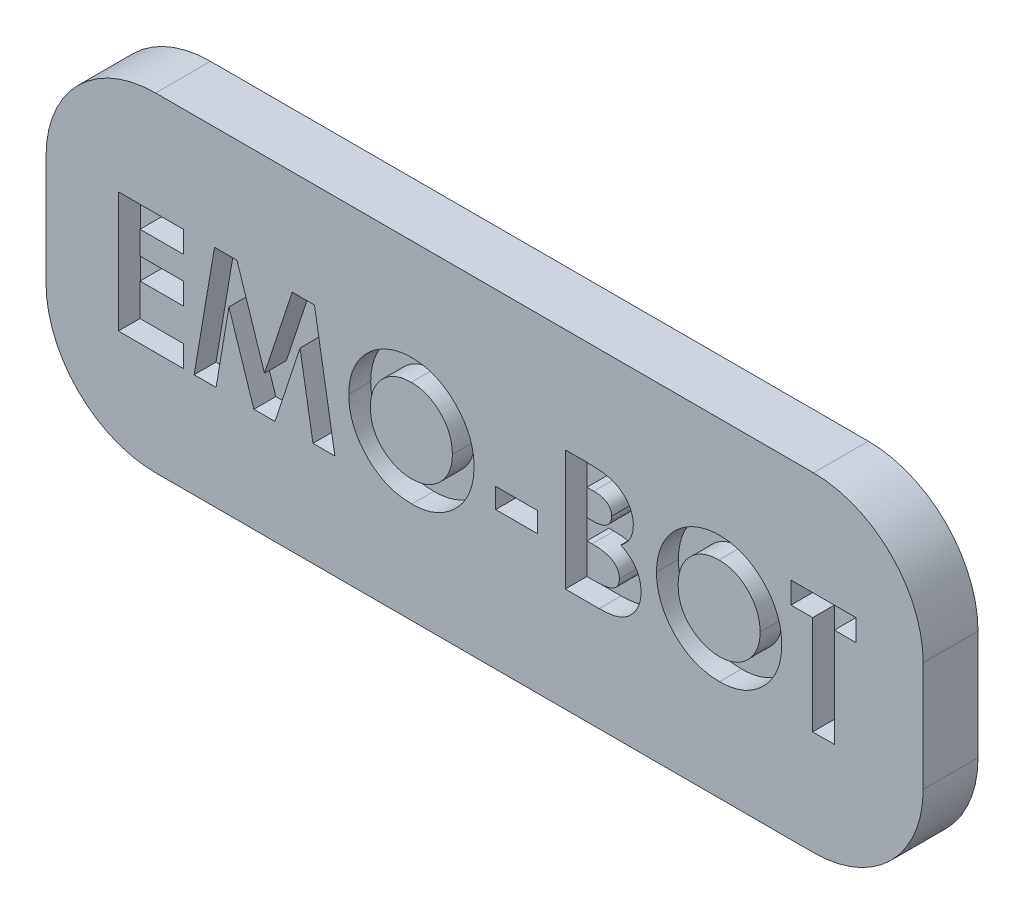
from build123d import *

# Parameters (mm, degrees)
SKETCH1_W           = 80
SKETCH1_H           = 30
BOSS_EXTRUDE1_DEPTH = 5
SKETCH2_W           = 3.807692308
SKETCH2_H           = 1.833333333
CUT_EXTRUDE1_DEPTH  = 2
FILLET1_R           = 10


with BuildPart() as part:
    # Sketch1 → Boss-Extrude1 (new body)
    with BuildSketch(Plane.XY):
        Rectangle(SKETCH1_W, SKETCH1_H)
    extrude(amount=-BOSS_EXTRUDE1_DEPTH)

    # Sketch2 → Cut-Extrude1 (cut)
    # profile 1 of 7: a face of its own
    with BuildSketch(Plane.XY):
        Polygon((-33.399654604, 5.5), (-27.476577681, 5.5), (-27.476577681, 3.525641026), (-31.42529563, 3.525641026), (-31.42529563, 1.41025641), (-27.476577681, 1.41025641), (-27.476577681, -0.564102564), (-31.42529563, -0.564102564), (-31.42529563, -3.525641026), (-27.476577681, -3.525641026), (-27.476577681, -5.5), (-33.399654604, -5.5), align=None)
    # profile 2 of 7: a face of its own
    with BuildSketch(Plane.XY):
        Polygon((-24.631826079, 5.5), (-22.582547233, 5.5), (-20.072731528, -2.172676282), (-17.545287617, 5.5), (-15.515840502, 5.5), (-13.656064861, -5.5), (-15.654662617, -5.5), (-16.829141784, 1.447716346), (-19.116401399, -5.5), (-21.04228281, -5.5), (-23.316321271, 1.447716346), (-24.488596912, -5.5), (-26.489398194, -5.5), align=None)
    # profile 3 of 7: a face of its own
    with BuildSketch(Plane.XY):
        with BuildLine():
            add(Edge.make_bspline(
                [(-6.653260374, 5.782051282), (-6.462011892, 5.777099516), (-6.084444074, 5.767323609), (-5.529178062, 5.685833795), (-4.994076592, 5.553057825), (-4.479381634, 5.368489624), (-3.986381926, 5.127130145), (-3.513338492, 4.83582209), (-3.061945751, 4.489067192), (-2.636829215, 4.094954672), (-2.243944865, 3.666374516), (-1.903510346, 3.204931782), (-1.613200277, 2.722582915), (-1.372590515, 2.218035447), (-1.189321396, 1.687795147), (-1.060713876, 1.134565539), (-0.978089915, 0.558504013), (-0.968586888, 0.166284631), (-0.963757169, -0.033052885)],
                knots=[0, 0, 0, 0, 1.014329547, 2.002516266, 2.970391464, 3.935626869, 4.897733899, 5.877609409, 6.878433252, 7.912639331, 8.949961323, 9.958554974, 10.949718813, 11.932905612, 12.9188844, 13.919928257, 14.942845884, 16, 16, 16, 16], degree=3))
            add(Edge.make_bspline(
                [(-0.963757169, -0.033052885), (-0.968900611, -0.230144327), (-0.97903593, -0.618519338), (-1.057340804, -1.18927223), (-1.188114092, -1.736575596), (-1.368274822, -2.261668269), (-1.604520832, -2.762006879), (-1.889169539, -3.24078602), (-2.229732279, -3.693562506), (-2.613787394, -4.12009336), (-3.036598745, -4.507261634), (-3.484423086, -4.848453007), (-3.955192641, -5.1375657), (-4.448218354, -5.374467287), (-4.964557495, -5.558317884), (-5.502934642, -5.688037839), (-6.063316482, -5.766871275), (-6.444403308, -5.776940391), (-6.637835694, -5.782051282)],
                knots=[0, 0, 0, 0, 1.051557043, 2.072126891, 3.067553643, 4.050577992, 5.02905126, 6.015227836, 7.017913613, 8.04756643, 9.074058332, 10.072836633, 11.047628519, 12.017157415, 12.98668631, 13.966869689, 14.968021931, 16, 16, 16, 16], degree=3))
            add(Edge.make_bspline(
                [(-6.637835694, -5.782051282), (-6.840142776, -5.777466561), (-7.23764854, -5.768458211), (-7.819400005, -5.682792916), (-8.376768176, -5.553751057), (-8.905070839, -5.361163004), (-9.409688306, -5.120411744), (-9.886913003, -4.823912134), (-10.336584553, -4.472154161), (-10.756123565, -4.074146479), (-11.136226926, -3.638638778), (-11.471742699, -3.178563512), (-11.754757697, -2.697435252), (-11.985282274, -2.19502882), (-12.16701859, -1.674466549), (-12.295212912, -1.132578064), (-12.370940357, -0.570663012), (-12.381488751, -0.188999076), (-12.386834092, 0.004407051)],
                knots=[0, 0, 0, 0, 1.067978421, 2.098431617, 3.099715153, 4.085208694, 5.062210972, 6.048429807, 7.046490867, 8.072918869, 9.098532598, 10.095778865, 11.076610158, 12.041847152, 13.011192615, 13.984257998, 14.978533688, 16, 16, 16, 16], degree=3))
            add(Edge.make_bspline(
                [(-12.386834092, 0.004407051), (-12.385156416, 0.134520569), (-12.381822307, 0.393100068), (-12.341659456, 0.776301686), (-12.283836497, 1.152023723), (-12.198319084, 1.51876817), (-12.094437286, 1.879122238), (-11.959843741, 2.229731663), (-11.806639863, 2.574341916), (-11.627635556, 2.90888272), (-11.428600075, 3.23027602), (-11.211434645, 3.537005747), (-10.975593205, 3.825363091), (-10.721835481, 4.097243016), (-10.449286987, 4.350858438), (-10.161532818, 4.589799634), (-9.852992218, 4.807719478), (-9.530418174, 5.009940006), (-9.195629283, 5.192804523), (-8.84998844, 5.348453331), (-8.500616529, 5.484378783), (-8.142846412, 5.59165716), (-7.780512234, 5.679034276), (-7.409743186, 5.736818263), (-7.033888957, 5.776980002), (-6.780437671, 5.780356844), (-6.653260374, 5.782051282)],
                knots=[0, 0, 0, 0, 1.034744296, 2.056386356, 3.06226378, 4.057406941, 5.050368692, 6.043467995, 7.042652155, 8.049140477, 9.059438543, 10.048523776, 11.036952808, 12.020949711, 13.004946614, 13.997082645, 14.994316842, 16.007702937, 17.024872941, 18.026463647, 19.021641123, 20.005082605, 20.995858141, 21.984425357, 22.988620895, 24, 24, 24, 24], degree=3))
        make_face()
        with BuildLine():
            add(Edge.make_bspline(
                [(-6.684109733, 3.807692308), (-6.812819935, 3.804238724), (-7.06684237, 3.797422732), (-7.43944702, 3.745494089), (-7.797160643, 3.662558145), (-8.13800029, 3.542426444), (-8.46344319, 3.389529277), (-8.774066253, 3.204400887), (-9.065567991, 2.980677691), (-9.341835299, 2.730370391), (-9.591397351, 2.451470535), (-9.811893297, 2.152581907), (-9.996412889, 1.834203647), (-10.150949203, 1.499293413), (-10.267280797, 1.144085228), (-10.350140304, 0.771361477), (-10.402504419, 0.380479937), (-10.409104981, 0.114016501), (-10.412475117, -0.022035256)],
                knots=[0, 0, 0, 0, 1.033739768, 2.040188636, 3.016340934, 3.979330865, 4.937572243, 5.900995986, 6.878200029, 7.884839167, 8.891893314, 9.879764717, 10.863503415, 11.843163062, 12.837761627, 13.859916423, 14.907309254, 16, 16, 16, 16], degree=3))
            add(Edge.make_bspline(
                [(-10.412475117, -0.022035256), (-10.408006831, -0.172811208), (-10.399249731, -0.46830709), (-10.337633711, -0.899368522), (-10.232214834, -1.306463262), (-10.079992025, -1.68760027), (-9.891195805, -2.047011787), (-9.656740865, -2.380292714), (-9.380424263, -2.689438582), (-9.167552192, -2.869930817), (-9.059510374, -2.961538462)],
                knots=[0, 0, 0, 0, 1.078454662, 2.113592447, 3.107694534, 4.079536787, 5.043276885, 6.005368276, 6.987637804, 8, 8, 8, 8], degree=3))
            add(Edge.make_bspline(
                [(-9.059510374, -2.961538462), (-8.971003498, -3.029214671), (-8.795983823, -3.163042334), (-8.516614315, -3.334569938), (-8.228918733, -3.481586206), (-7.930726052, -3.600373611), (-7.62266604, -3.693809787), (-7.304780942, -3.759241605), (-6.977521173, -3.800305729), (-6.75621278, -3.80521367), (-6.644446271, -3.807692308)],
                knots=[0, 0, 0, 0, 1.023928204, 2.024787132, 3.009472467, 3.9914905, 4.972207045, 5.96565515, 6.972602802, 8, 8, 8, 8], degree=3))
            add(Edge.make_bspline(
                [(-6.644446271, -3.807692308), (-6.517949244, -3.804209441), (-6.269062364, -3.797356792), (-5.90339395, -3.74606742), (-5.553072504, -3.659267284), (-5.2159232, -3.540189421), (-4.892918226, -3.385372498), (-4.585636194, -3.194502005), (-4.293538357, -2.969921588), (-4.017623011, -2.716327205), (-3.765423341, -2.436328676), (-3.545387525, -2.135845807), (-3.355001132, -1.821499135), (-3.203678403, -1.48883956), (-3.08275081, -1.141007231), (-3.00088856, -0.776461676), (-2.948082087, -0.396705688), (-2.941479665, -0.138268318), (-2.938116143, -0.006610577)],
                knots=[0, 0, 0, 0, 1.026359118, 2.019393844, 2.989460624, 3.950973911, 4.916101784, 5.890408035, 6.881132271, 7.902007068, 8.92769091, 9.933912415, 10.920395702, 11.90457117, 12.894218921, 13.903490204, 14.931958862, 16, 16, 16, 16], degree=3))
            add(Edge.make_bspline(
                [(-2.938116143, -0.006610577), (-2.941596044, 0.124290095), (-2.948445698, 0.381948105), (-2.999825342, 0.760727743), (-3.086075014, 1.123663937), (-3.205510456, 1.4713494), (-3.358023191, 1.804124994), (-3.54662066, 2.120820481), (-3.770641098, 2.421129696), (-4.024928688, 2.703006146), (-4.3017051, 2.962032547), (-4.598852235, 3.186820378), (-4.90805558, 3.382153855), (-5.23640977, 3.535170214), (-5.577196953, 3.657078022), (-5.93249663, 3.746852682), (-6.30365452, 3.79705793), (-6.556160907, 3.804115918), (-6.684109733, 3.807692308)],
                knots=[0, 0, 0, 0, 1.055025985, 2.07665775, 3.074803781, 4.057872707, 5.035505728, 6.020516407, 7.023567878, 8.050795229, 9.077271434, 10.074415901, 11.050397877, 12.019801805, 12.988065821, 13.964604439, 14.968634123, 16, 16, 16, 16], degree=3))
        make_face(mode=Mode.SUBTRACT)
    # profile 4 of 7: a face of its own
    with BuildSketch(Plane.XY):
        with Locations((2.91444796, -1.480769231)):
            Rectangle(SKETCH2_W, SKETCH2_H)
    # profile 5 of 7: a face of its own
    with BuildSketch(Plane.XY):
        with BuildLine():
            Line((7.356755652, -5.5), (7.356755652, 5.5))
            Line((7.356755652, 5.5), (9.119576165, 5.5))
            add(Edge.make_bspline(
                [(9.119576165, 5.5), (9.242984623, 5.500014084), (9.48177765, 5.500041336), (9.826293669, 5.487943065), (10.145803182, 5.472292595), (10.439289384, 5.454783359), (10.707251811, 5.424611447), (10.949282981, 5.392813548), (11.165866475, 5.354467241), (11.29976828, 5.320069416), (11.362765267, 5.303886218)],
                knots=[0, 0, 0, 0, 1.311965854, 2.538629056, 3.664479157, 4.713267157, 5.663616078, 6.530575999, 7.308677837, 8, 8, 8, 8], degree=3))
            add(Edge.make_bspline(
                [(11.362765267, 5.303886218), (11.445486708, 5.281059529), (11.607812731, 5.236266239), (11.840315397, 5.145804252), (12.060876608, 5.04524934), (12.269227065, 4.930534992), (12.464087413, 4.800276285), (12.644717117, 4.653439446), (12.815011911, 4.4959185), (12.968925017, 4.323323382), (13.108037106, 4.140944669), (13.22890057, 3.948830148), (13.333915429, 3.749917377), (13.417954822, 3.541703169), (13.481276927, 3.325146408), (13.52759045, 3.101171825), (13.557607884, 2.86907071), (13.560444138, 2.711164734), (13.561883857, 2.631009615)],
                knots=[0, 0, 0, 0, 1.099996261, 2.158545794, 3.195537121, 4.207578794, 5.205712374, 6.197378256, 7.190519799, 8.17788031, 9.159561366, 10.129234751, 11.085776129, 12.040971148, 13.00380137, 13.975669004, 14.972423361, 16, 16, 16, 16], degree=3))
            add(Edge.make_bspline(
                [(13.561883857, 2.631009615), (13.558119419, 2.528031327), (13.550709586, 2.32533122), (13.503375064, 2.027601434), (13.414615461, 1.746203993), (13.298475679, 1.475952848), (13.140561885, 1.217856038), (12.940041908, 0.97203628), (12.700163515, 0.730924415), (12.516163545, 0.586394116), (12.420457575, 0.511217949)],
                knots=[0, 0, 0, 0, 0.986156485, 1.941127874, 2.875419072, 3.804401753, 4.751181392, 5.761612777, 6.835722519, 8, 8, 8, 8], degree=3))
            add(Edge.make_bspline(
                [(12.420457575, 0.511217949), (12.498013102, 0.471626525), (12.650078034, 0.393998696), (12.865965562, 0.266401719), (13.065853848, 0.130686151), (13.250639129, -0.010417356), (13.416445322, -0.162890384), (13.570118844, -0.317947228), (13.704078241, -0.484472), (13.823868772, -0.65652944), (13.927988754, -0.83661096), (14.018665777, -1.024412442), (14.095257405, -1.220575458), (14.160117177, -1.424101697), (14.208489613, -1.635691193), (14.240029469, -1.85541962), (14.264178355, -2.082537591), (14.266056911, -2.237244682), (14.267012062, -2.315905449)],
                knots=[0, 0, 0, 0, 1.164658916, 2.283573913, 3.35186032, 4.395461096, 5.390182219, 6.362969632, 7.312859996, 8.245001507, 9.165155236, 10.092416118, 11.032087915, 11.979892451, 12.947605196, 13.931445124, 14.948243989, 16, 16, 16, 16], degree=3))
            add(Edge.make_bspline(
                [(14.267012062, -2.315905449), (14.260813769, -2.466143016), (14.248581461, -2.762636251), (14.159144796, -3.197956416), (14.004090036, -3.610679415), (13.795883468, -3.999164912), (13.539332916, -4.352166888), (13.244373352, -4.661393555), (12.913974341, -4.923147063), (12.60914132, -5.099810375), (12.345484763, -5.218367978), (12.127102963, -5.291667764), (11.892565538, -5.359572575), (11.637576327, -5.407256736), (11.366757936, -5.450902523), (11.077469868, -5.477850336), (10.770252799, -5.496112205), (10.559242835, -5.498677868), (10.450505652, -5.5)],
                knots=[0, 0, 0, 0, 1.284142165, 2.534249414, 3.780121997, 5.041676246, 6.291546858, 7.49970053, 8.684500223, 9.883330709, 10.50184324, 11.153274765, 11.851151195, 12.587658647, 13.369265475, 14.195992086, 15.070362669, 16, 16, 16, 16], degree=3))
            Line((10.450505652, -5.5), (7.356755652, -5.5))
        make_face()
        with BuildLine():
            Line((9.331114626, 3.525641026), (9.331114626, 1.128205128))
            Line((9.331114626, 1.128205128), (9.855553729, 1.128205128))
            add(Edge.make_bspline(
                [(9.855553729, 1.128205128), (9.926829715, 1.128826682), (10.064423692, 1.130026553), (10.263163597, 1.145480482), (10.447959614, 1.171845845), (10.61811085, 1.208632158), (10.775202327, 1.255345412), (10.918230499, 1.311551517), (11.046566496, 1.380129074), (11.195663243, 1.482278372), (11.353269256, 1.632595637), (11.492008056, 1.849760071), (11.573724284, 2.099498343), (11.582825267, 2.275633111), (11.587524883, 2.366586538)],
                knots=[0, 0, 0, 0, 1.065314748, 2.056525647, 2.977365736, 3.853934255, 4.656397591, 5.425096493, 6.14721249, 6.826394842, 8.123232004, 9.372140726, 10.643011755, 12, 12, 12, 12], degree=3))
            add(Edge.make_bspline(
                [(11.587524883, 2.366586538), (11.58376433, 2.451779535), (11.576493453, 2.616496771), (11.494215718, 2.84777444), (11.366422131, 3.052733789), (11.215543839, 3.193011701), (11.073462609, 3.28881738), (10.951803941, 3.351901339), (10.818274417, 3.408373455), (10.670289049, 3.451553411), (10.508692915, 3.48395413), (10.334270977, 3.507748577), (10.146722298, 3.523944091), (10.017182026, 3.525063248), (9.950305331, 3.525641026)],
                knots=[0, 0, 0, 0, 1.347982417, 2.606269829, 3.849316587, 5.153353503, 5.842674298, 6.568177932, 7.326619318, 8.142485038, 9.012069166, 9.942760135, 10.937925643, 12, 12, 12, 12], degree=3))
            Line((9.950305331, 3.525641026), (9.331114626, 3.525641026))
        make_face(mode=Mode.SUBTRACT)
        with BuildLine():
            Line((9.331114626, -0.705128205), (9.331114626, -3.525641026))
            Line((9.331114626, -3.525641026), (9.899624242, -3.525641026))
            add(Edge.make_bspline(
                [(9.899624242, -3.525641026), (10.012019317, -3.524998917), (10.228112873, -3.523764382), (10.53766651, -3.50884827), (10.819128154, -3.481964606), (11.071752039, -3.448402518), (11.295925105, -3.402931137), (11.490889594, -3.345120104), (11.659319192, -3.281517899), (11.800203985, -3.202961623), (11.915298791, -3.111541599), (12.019159785, -3.018108139), (12.103841569, -2.910323815), (12.170843376, -2.792815509), (12.228833322, -2.668502214), (12.263808762, -2.532529539), (12.290437835, -2.388927389), (12.291903304, -2.289600887), (12.292653088, -2.238782051)],
                knots=[0, 0, 0, 0, 1.753078804, 3.370512758, 4.83203934, 6.162291463, 7.344201807, 8.395507345, 9.331626367, 10.147333109, 10.898971645, 11.62040215, 12.321813352, 13.025280112, 13.727906689, 14.453419512, 15.208716525, 16, 16, 16, 16], degree=3))
            add(Edge.make_bspline(
                [(12.292653088, -2.238782051), (12.290999599, -2.180669913), (12.287779046, -2.067483102), (12.261476758, -1.902048497), (12.213676907, -1.747604318), (12.153470663, -1.600201216), (12.069690476, -1.465116738), (11.970120587, -1.337676121), (11.849814742, -1.222194898), (11.714523801, -1.111688334), (11.556720313, -1.01493385), (11.376330241, -0.930982196), (11.172373608, -0.860868867), (10.944218636, -0.805044589), (10.69286554, -0.757667295), (10.416479719, -0.729377821), (10.117363008, -0.708337695), (9.909950612, -0.706222344), (9.802669114, -0.705128205)],
                knots=[0, 0, 0, 0, 0.845221588, 1.646264278, 2.427170338, 3.19324141, 3.95557735, 4.731569926, 5.540061037, 6.376114724, 7.268642756, 8.224665384, 9.265483498, 10.400594375, 11.639216012, 12.983232105, 14.439614077, 16, 16, 16, 16], degree=3))
            Line((9.802669114, -0.705128205), (9.331114626, -0.705128205))
        make_face(mode=Mode.SUBTRACT)
    # profile 6 of 7: a face of its own
    with BuildSketch(Plane.XY):
        with BuildLine():
            add(Edge.make_bspline(
                [(21.41084219, 5.782051282), (21.602090672, 5.777099516), (21.97965849, 5.767323609), (22.534924502, 5.685833795), (23.070025972, 5.553057825), (23.58472093, 5.368489624), (24.077720638, 5.127130145), (24.550764072, 4.83582209), (25.002156813, 4.489067192), (25.427273349, 4.094954672), (25.820157699, 3.666374516), (26.160592219, 3.204931782), (26.450902287, 2.722582915), (26.691512049, 2.218035447), (26.874781168, 1.687795147), (27.003388689, 1.134565539), (27.086012649, 0.558504013), (27.095515676, 0.166284631), (27.100345396, -0.033052885)],
                knots=[0, 0, 0, 0, 1.014329547, 2.002516266, 2.970391464, 3.935626869, 4.897733899, 5.877609409, 6.878433252, 7.912639331, 8.949961323, 9.958554974, 10.949718813, 11.932905612, 12.9188844, 13.919928257, 14.942845884, 16, 16, 16, 16], degree=3))
            add(Edge.make_bspline(
                [(27.100345396, -0.033052885), (27.095201953, -0.230144327), (27.085066634, -0.618519338), (27.00676176, -1.18927223), (26.875988473, -1.736575596), (26.695827742, -2.261668269), (26.459581732, -2.762006879), (26.174933025, -3.24078602), (25.834370285, -3.693562506), (25.450315171, -4.12009336), (25.027503819, -4.507261634), (24.579679478, -4.848453007), (24.108909923, -5.1375657), (23.61588421, -5.374467287), (23.099545069, -5.558317884), (22.561167922, -5.688037839), (22.000786082, -5.766871275), (21.619699256, -5.776940391), (21.42626687, -5.782051282)],
                knots=[0, 0, 0, 0, 1.051557043, 2.072126891, 3.067553643, 4.050577992, 5.02905126, 6.015227836, 7.017913613, 8.04756643, 9.074058332, 10.072836633, 11.047628519, 12.017157415, 12.98668631, 13.966869689, 14.968021931, 16, 16, 16, 16], degree=3))
            add(Edge.make_bspline(
                [(21.42626687, -5.782051282), (21.223959788, -5.777466561), (20.826454024, -5.768458211), (20.244702559, -5.682792916), (19.687334388, -5.553751057), (19.159031725, -5.361163004), (18.654414258, -5.120411744), (18.177189561, -4.823912134), (17.727518011, -4.472154161), (17.307978999, -4.074146479), (16.927875638, -3.638638778), (16.592359865, -3.178563512), (16.309344867, -2.697435252), (16.07882029, -2.19502882), (15.897083974, -1.674466549), (15.768889652, -1.132578064), (15.693162207, -0.570663012), (15.682613814, -0.188999076), (15.677268472, 0.004407051)],
                knots=[0, 0, 0, 0, 1.067978421, 2.098431617, 3.099715153, 4.085208694, 5.062210972, 6.048429807, 7.046490867, 8.072918869, 9.098532598, 10.095778865, 11.076610158, 12.041847152, 13.011192615, 13.984257998, 14.978533688, 16, 16, 16, 16], degree=3))
            add(Edge.make_bspline(
                [(15.677268472, 0.004407051), (15.678946148, 0.134520569), (15.682280257, 0.393100068), (15.722443109, 0.776301686), (15.780266067, 1.152023723), (15.86578348, 1.51876817), (15.969665279, 1.879122238), (16.104258823, 2.229731663), (16.257462701, 2.574341916), (16.436467008, 2.90888272), (16.635502489, 3.23027602), (16.852667919, 3.537005747), (17.088509359, 3.825363091), (17.342267084, 4.097243016), (17.614815577, 4.350858438), (17.902569746, 4.589799634), (18.211110346, 4.807719478), (18.53368439, 5.009940006), (18.868473281, 5.192804523), (19.214114124, 5.348453331), (19.563486035, 5.484378783), (19.921256152, 5.59165716), (20.28359033, 5.679034276), (20.654359378, 5.736818263), (21.030213607, 5.776980002), (21.283664893, 5.780356844), (21.41084219, 5.782051282)],
                knots=[0, 0, 0, 0, 1.034744296, 2.056386356, 3.06226378, 4.057406941, 5.050368692, 6.043467995, 7.042652155, 8.049140477, 9.059438543, 10.048523776, 11.036952808, 12.020949711, 13.004946614, 13.997082645, 14.994316842, 16.007702937, 17.024872941, 18.026463647, 19.021641123, 20.005082605, 20.995858141, 21.984425357, 22.988620895, 24, 24, 24, 24], degree=3))
        make_face()
        with BuildLine():
            add(Edge.make_bspline(
                [(21.379992831, 3.807692308), (21.251282629, 3.804238724), (20.997260194, 3.797422732), (20.624655544, 3.745494089), (20.266941922, 3.662558145), (19.926102274, 3.542426444), (19.600659374, 3.389529277), (19.290036311, 3.204400887), (18.998534573, 2.980677691), (18.722267265, 2.730370391), (18.472705213, 2.451470535), (18.252209267, 2.152581907), (18.067689675, 1.834203647), (17.913153361, 1.499293413), (17.796821767, 1.144085228), (17.71396226, 0.771361477), (17.661598145, 0.380479937), (17.654997583, 0.114016501), (17.651627447, -0.022035256)],
                knots=[0, 0, 0, 0, 1.033739768, 2.040188636, 3.016340934, 3.979330865, 4.937572243, 5.900995986, 6.878200029, 7.884839167, 8.891893314, 9.879764717, 10.863503415, 11.843163062, 12.837761627, 13.859916423, 14.907309254, 16, 16, 16, 16], degree=3))
            add(Edge.make_bspline(
                [(17.651627447, -0.022035256), (17.656095733, -0.172811208), (17.664852833, -0.46830709), (17.726468853, -0.899368522), (17.83188773, -1.306463262), (17.984110539, -1.68760027), (18.172906759, -2.047011787), (18.407361699, -2.380292714), (18.683678301, -2.689438582), (18.896550372, -2.869930817), (19.00459219, -2.961538462)],
                knots=[0, 0, 0, 0, 1.078454662, 2.113592447, 3.107694534, 4.079536787, 5.043276885, 6.005368276, 6.987637804, 8, 8, 8, 8], degree=3))
            add(Edge.make_bspline(
                [(19.00459219, -2.961538462), (19.093099066, -3.029214671), (19.268118742, -3.163042334), (19.547488249, -3.334569938), (19.835183831, -3.481586206), (20.133376512, -3.600373611), (20.441436524, -3.693809787), (20.759321622, -3.759241605), (21.086581391, -3.800305729), (21.307889784, -3.80521367), (21.419656293, -3.807692308)],
                knots=[0, 0, 0, 0, 1.023928204, 2.024787132, 3.009472467, 3.9914905, 4.972207045, 5.96565515, 6.972602802, 8, 8, 8, 8], degree=3))
            add(Edge.make_bspline(
                [(21.419656293, -3.807692308), (21.54615332, -3.804209441), (21.7950402, -3.797356792), (22.160708614, -3.74606742), (22.51103006, -3.659267284), (22.848179364, -3.540189421), (23.171184339, -3.385372498), (23.47846637, -3.194502005), (23.770564207, -2.969921588), (24.046479553, -2.716327205), (24.298679223, -2.436328676), (24.518715039, -2.135845807), (24.709101432, -1.821499135), (24.860424161, -1.48883956), (24.981351754, -1.141007231), (25.063214004, -0.776461676), (25.116020477, -0.396705688), (25.122622899, -0.138268318), (25.125986421, -0.006610577)],
                knots=[0, 0, 0, 0, 1.026359118, 2.019393844, 2.989460624, 3.950973911, 4.916101784, 5.890408035, 6.881132271, 7.902007068, 8.92769091, 9.933912415, 10.920395702, 11.90457117, 12.894218921, 13.903490204, 14.931958862, 16, 16, 16, 16], degree=3))
            add(Edge.make_bspline(
                [(25.125986421, -0.006610577), (25.12250652, 0.124290095), (25.115656866, 0.381948105), (25.064277222, 0.760727743), (24.97802755, 1.123663937), (24.858592108, 1.4713494), (24.706079373, 1.804124994), (24.517481904, 2.120820481), (24.293461466, 2.421129696), (24.039173876, 2.703006146), (23.762397464, 2.962032547), (23.465250329, 3.186820378), (23.156046984, 3.382153855), (22.827692794, 3.535170214), (22.486905611, 3.657078022), (22.131605934, 3.746852682), (21.760448044, 3.79705793), (21.507941657, 3.804115918), (21.379992831, 3.807692308)],
                knots=[0, 0, 0, 0, 1.055025985, 2.07665775, 3.074803781, 4.057872707, 5.035505728, 6.020516407, 7.023567878, 8.050795229, 9.077271434, 10.074415901, 11.050397877, 12.019801805, 12.988065821, 13.964604439, 14.968634123, 16, 16, 16, 16], degree=3))
        make_face(mode=Mode.SUBTRACT)
    # profile 7 of 7: a face of its own
    with BuildSketch(Plane.XY):
        Polygon((27.946499242, 5.5), (33.869576165, 5.5), (33.869576165, 3.525641026), (31.89521719, 3.525641026), (31.89521719, -5.5), (29.920858216, -5.5), (29.920858216, 3.525641026), (27.946499242, 3.525641026), align=None)
    extrude(amount=-CUT_EXTRUDE1_DEPTH, mode=Mode.SUBTRACT)

    # Fillet1
    fillet1_edges = [part.edges().sort_by_distance(p)[0] for p in [
        (40, -15, -2.5),
        (-40, -15, -2.5),
        (-40, 15, -2.5),
        (40, 15, -2.5),
    ]]
    fillet(fillet1_edges, radius=FILLET1_R)


solid = part.part
